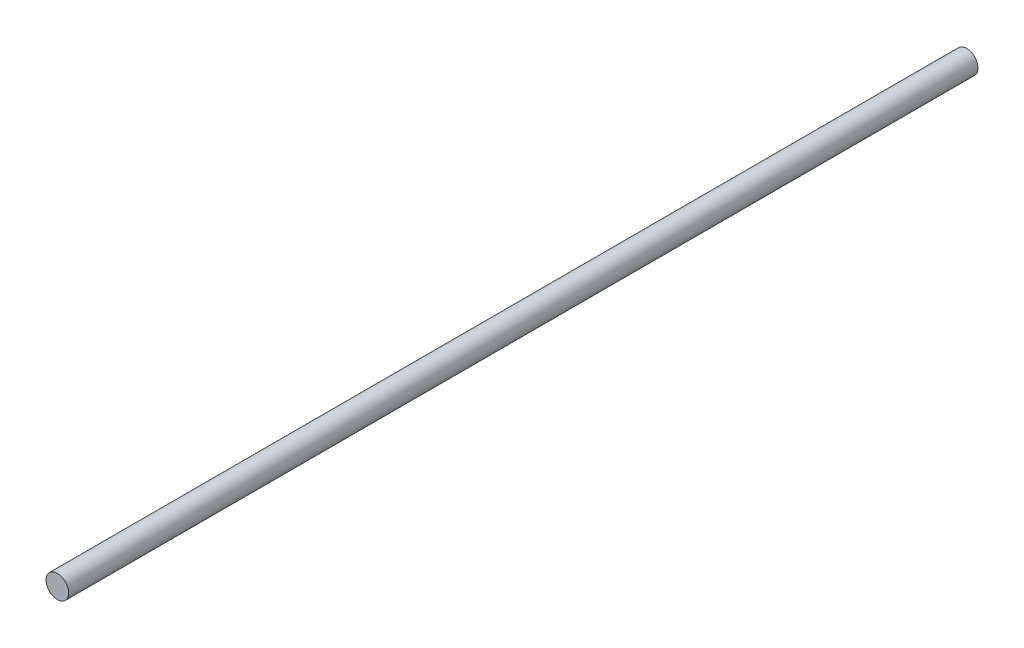
from build123d import *

# Parameters (mm, degrees)
SKETCH1_R           = 0.5
BOSS_EXTRUDE1_DEPTH = 40


with BuildPart() as part:
    # Sketch1 → Boss-Extrude1 (new body)
    with BuildSketch(Plane.XY):
        Circle(SKETCH1_R)
    extrude(amount=BOSS_EXTRUDE1_DEPTH)


solid = part.part
